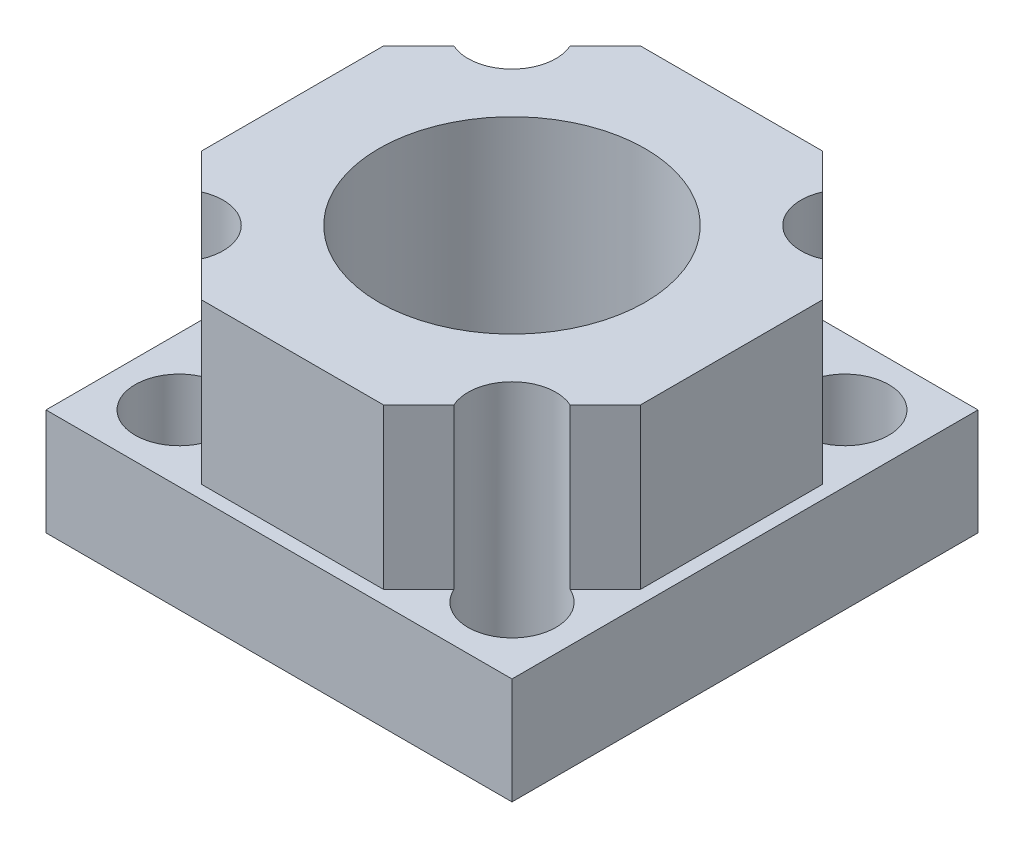
from build123d import *
from build123d.topology import SkipClean

# Parameters (mm, degrees)
SKETCH1_W               = 35
SKETCH1_H               = 35
BOSS_EXTRUDE1_DEPTH     = 8
BOSS_EXTRUDE2_DEPTH     = 12
M18_CLEARANCE_HOLE1_D   = 20
SKETCH5_W               = 3.3
SKETCH5_H               = 8
CUT_EXTRUDE1_DEPTH      = 28.504545079
MIRROR5_COPY_1_SKETCH_W = 3.3
MIRROR5_COPY_1_SKETCH_H = 8
CUT_EXTRUDE2_DEPTH      = 28.504545079


with BuildPart() as part:
    # Sketch1 → Boss-Extrude1 (new body)
    with BuildSketch(Plane(origin=(0, 0, 0), x_dir=(1, 0, 0), z_dir=(0, 1, 0))):
        Rectangle(SKETCH1_W, SKETCH1_H)
    extrude(amount=-BOSS_EXTRUDE1_DEPTH)

    # Sketch1<3> → Boss-Extrude2 (add)
    with BuildSketch(Plane(origin=(0, 0, 0), x_dir=(1, 0, 0), z_dir=(0, 1, 0))):
        Polygon((-16.5, 6.834523779), (-16.5, -6.834523779), (-6.834523779, -16.5), (6.834523779, -16.5), (16.5, -6.834523779), (16.5, 6.834523779), (6.834523779, 16.5), (-6.834523779, 16.5), align=None)
    extrude(amount=BOSS_EXTRUDE2_DEPTH)

    # M18 Clearance Hole1 (through all)
    with Locations(Plane(origin=(0, 12, 0), x_dir=(1, 0, 0), z_dir=(0, 1, 0))):
        with Locations((0, 0)):
            Hole(M18_CLEARANCE_HOLE1_D / 2)

    # Sketch5 → M6 Clearance Hole1 (revolve, cut)
    with BuildSketch(Plane(origin=(-12.5, 0, -12.5), x_dir=(0, 0, 1), z_dir=(1, 0, 0))):
        with Locations((1.65, 4)):
            Rectangle(SKETCH5_W, SKETCH5_H)
    m6_clearance_hole1 = revolve(axis=Axis((-12.5, 6.35, -12.5), (0, -1, 0)), mode=Mode.SUBTRACT)

    # Sketch6 → Cut-Extrude1 (cut, through all)
    with SkipClean():  # the faces are left unmerged after this step: merging them gives an invalid solid
        with BuildSketch(Plane.XZ):
            with BuildLine():
                Line((-13.847066294, -9.487457486), (-9.487457486, -13.847066294))
                ThreePointArc((-9.487457486, -13.847066294), (-10.166547622, -10.166547622), (-13.847066294, -9.487457486))
            make_face()
        extrude(amount=-CUT_EXTRUDE1_DEPTH, mode=Mode.SUBTRACT)

    # Mirror4: M6 Clearance Hole1 across plane
    with SkipClean():  # the faces are left unmerged after this step: merging them gives an invalid solid
        add(m6_clearance_hole1.mirror(Plane(origin=(0, 0, 0), x_dir=(0, 0, 1), z_dir=(1, 0, 0))), mode=Mode.SUBTRACT)

    # Mirror5: M6 Clearance Hole1 across plane
    with SkipClean():  # the faces are left unmerged after this step: merging them gives an invalid solid
        add(m6_clearance_hole1.mirror(Plane.XY), mode=Mode.SUBTRACT)

    # Mirror5 copy 1 sketch → Mirror5 copy 1 (revolve, cut)
    with SkipClean():  # the faces are left unmerged after this step: merging them gives an invalid solid
        with BuildSketch(Plane(origin=(12.5, 0, 12.5), x_dir=(0, 0, -1), z_dir=(-1, 0, 0))):
            with Locations((1.65, 4)):
                Rectangle(MIRROR5_COPY_1_SKETCH_W, MIRROR5_COPY_1_SKETCH_H)
        revolve(axis=Axis((12.5, 6.35, 12.5), (0, -1, 0)), mode=Mode.SUBTRACT)

    # Sketch7 → Cut-Extrude2 (cut, through all)
    with SkipClean():  # the faces are left unmerged after this step: merging them gives an invalid solid
        with BuildSketch(Plane.XZ):
            with BuildLine():
                Line((-9.487457486, 13.847066294), (-13.847066294, 9.487457486))
                ThreePointArc((-13.847066294, 9.487457486), (-10.166547622, 10.166547622), (-9.487457486, 13.847066294))
            make_face()
            with BuildLine():
                Line((13.847066294, 9.487457486), (9.487457486, 13.847066294))
                ThreePointArc((9.487457486, 13.847066294), (10.166547622, 10.166547622), (13.847066294, 9.487457486))
            make_face()
            with BuildLine():
                Line((9.487457486, -13.847066294), (13.847066294, -9.487457486))
                ThreePointArc((13.847066294, -9.487457486), (10.166547622, -10.166547622), (9.487457486, -13.847066294))
            make_face()
        extrude(amount=-CUT_EXTRUDE2_DEPTH, mode=Mode.SUBTRACT)


solid = part.part
